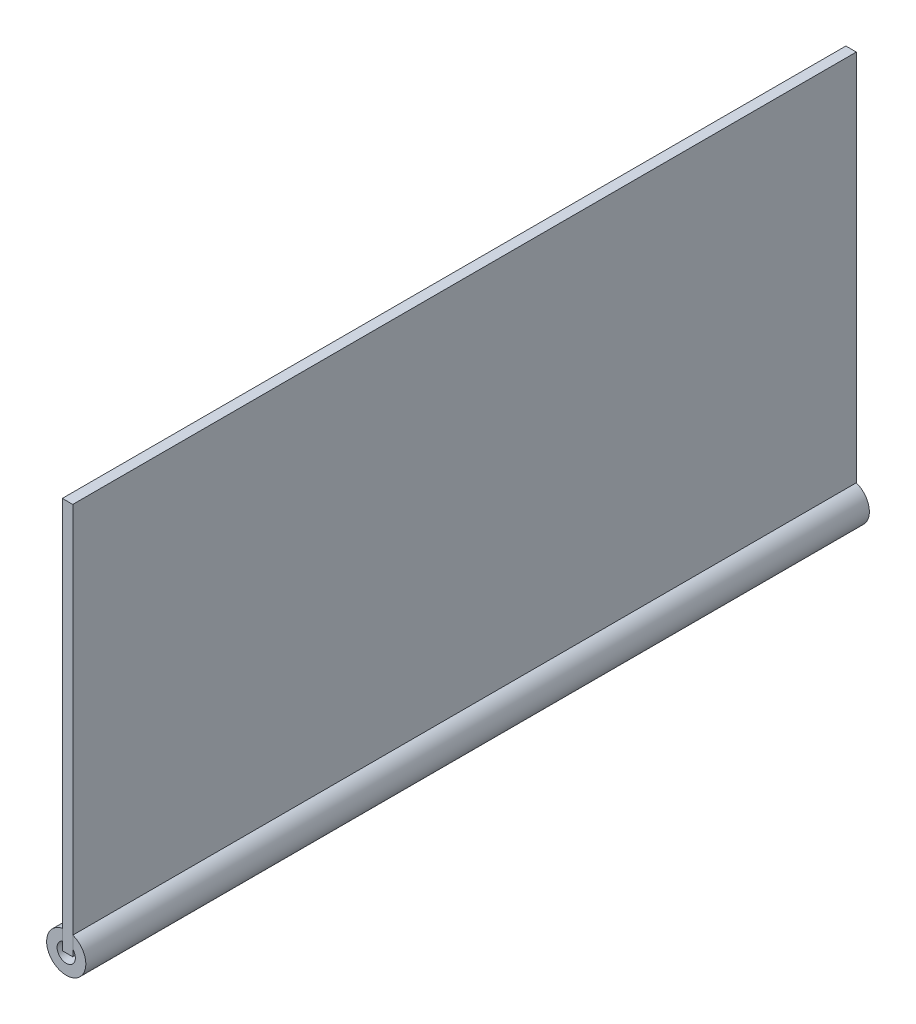
from build123d import *

# Parameters (mm, degrees)
SCHIZZO1_W                   = 300
SCHIZZO1_H                   = 149.8
ESTRUSIONE_ESTRUSIONE1_DEPTH = 3
SCHIZZO2_R                   = 7.5
SCHIZZO3_R                   = 3.5
TAGLIO_ESTRUSIONE1_DEPTH     = 312.240678575
SCHIZZO4_W                   = 300
SCHIZZO4_H                   = 150
ESTRUSIONE_ESTRUSIONE2_DEPTH = 4


with BuildPart() as part:
    # Schizzo1 → Estrusione-Estrusione1 (new body)
    with BuildSketch(Plane(origin=(0, 0, 0), x_dir=(0, 0, -1), z_dir=(1, 0, 0))):
        Rectangle(SCHIZZO1_W, SCHIZZO1_H)
    extrude(amount=ESTRUSIONE_ESTRUSIONE1_DEPTH)

    # Sweep1: sweep along a curve in space
    with BuildLine() as sweep1_path:
        Line((3, -74.9, 150), (3, -74.9, -150))
    # Schizzo2 → Sweep1 (sweep)
    with BuildSketch(Plane.XY.offset(150)):
        with Locations((1.5, -74.9)):
            Circle(SCHIZZO2_R)
    sweep(path=sweep1_path.line)

    # Schizzo3 → Taglio-Estrusione1 (cut, through all)
    with BuildSketch(Plane.XY.offset(150)):
        with Locations((1.5, -74.9)):
            Circle(SCHIZZO3_R)
    extrude(amount=-TAGLIO_ESTRUSIONE1_DEPTH, mode=Mode.SUBTRACT)


with BuildPart() as body_2:
    # Schizzo4 → Estrusione-Estrusione2 (new body)
    with BuildSketch(Plane(origin=(0, 0, 0), x_dir=(0, 0, -1), z_dir=(1, 0, 0))):
        Rectangle(SCHIZZO4_W, SCHIZZO4_H)
    extrude(amount=ESTRUSIONE_ESTRUSIONE2_DEPTH)


solid = Compound([part.part, body_2.part])
